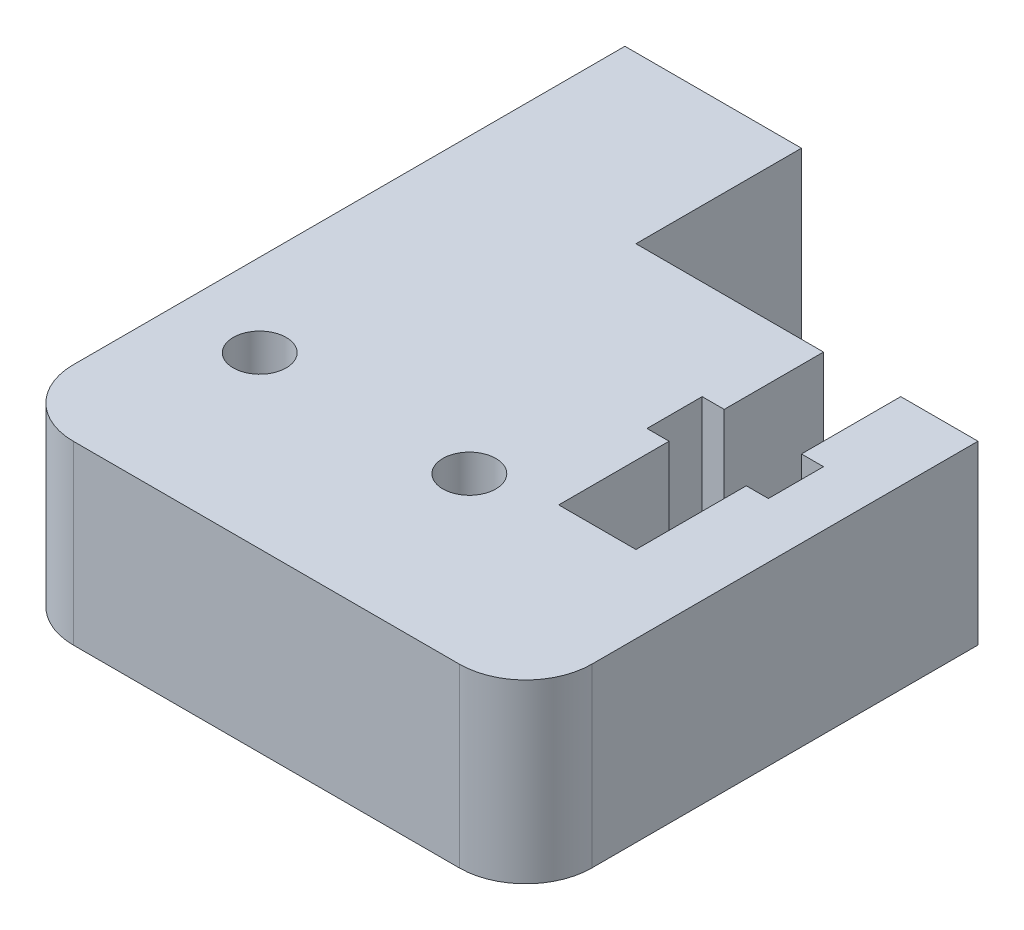
from build123d import *

# Parameters (mm, degrees)
SKETCH1_R      = 1.2
EXTRUDE1_DEPTH = 8
SKETCH2_R      = 1
EXTRUDE2_DEPTH = 1


with BuildPart() as part:
    # Sketch1 → Extrude1 (new body)
    with BuildSketch(Plane(origin=(0, 0, 0), x_dir=(1, 0, 0), z_dir=(0, 1, 0))):
        with BuildLine():
            Line((26.419805568, 30.469633485), (26.419805568, 25.969633485))
            Line((26.419805568, 25.969633485), (25.419805568, 25.969633485))
            Line((25.419805568, 25.969633485), (25.419805568, 23.469633485))
            Line((25.419805568, 23.469633485), (26.419805568, 23.469633485))
            Line((26.419805568, 23.469633485), (26.419805568, 18.469633485))
            Line((26.419805568, 18.469633485), (29.919805568, 18.469633485))
            Line((29.919805568, 18.469633485), (29.919805568, 23.469633485))
            Line((29.919805568, 23.469633485), (30.919805568, 23.469633485))
            Line((30.919805568, 23.469633485), (30.919805568, 25.969633485))
            Line((30.919805568, 25.969633485), (29.919805568, 25.969633485))
            Line((29.919805568, 25.969633485), (29.919805568, 30.469633485))
            Line((29.919805568, 30.469633485), (33.419805568, 30.469633485))
            Line((33.419805568, 30.469633485), (33.419805568, 12.969633485))
            ThreePointArc((33.419805568, 12.969633485), (32.541125911, 10.848313142), (30.419805568, 9.969633485))
            Line((30.419805568, 9.969633485), (12.919805568, 9.969633485))
            ThreePointArc((12.919805568, 9.969633485), (10.798485224, 10.848313142), (9.919805568, 12.969633485))
            Line((9.919805568, 12.969633485), (9.919805568, 30.469633485))
            Line((9.919805568, 30.469633485), (9.919805568, 37.969633485))
            Line((9.919805568, 37.969633485), (17.919805568, 37.969633485))
            Line((17.919805568, 37.969633485), (17.919805568, 30.469633485))
            Line((17.919805568, 30.469633485), (26.419805568, 30.469633485))
        make_face()
        with Locations(Location((23.169805568, 17.669633485, 0), (0, 0, 270))):
            Circle(SKETCH1_R, mode=Mode.SUBTRACT)
        with Locations(Location((13.669805568, 17.669633485, 0), (0, 0, 270))):
            Circle(SKETCH1_R, mode=Mode.SUBTRACT)
    extrude(amount=EXTRUDE1_DEPTH)

    # Sketch2 → Extrude2 (cut)
    with BuildSketch(Plane(origin=(0, 0, -18.469633485), x_dir=(-1, 0, 0), z_dir=(0, 0, -1))):
        with Locations((-28.169805568, 4)):
            Circle(SKETCH2_R)
    extrude(amount=-EXTRUDE2_DEPTH, mode=Mode.SUBTRACT)


solid = part.part
